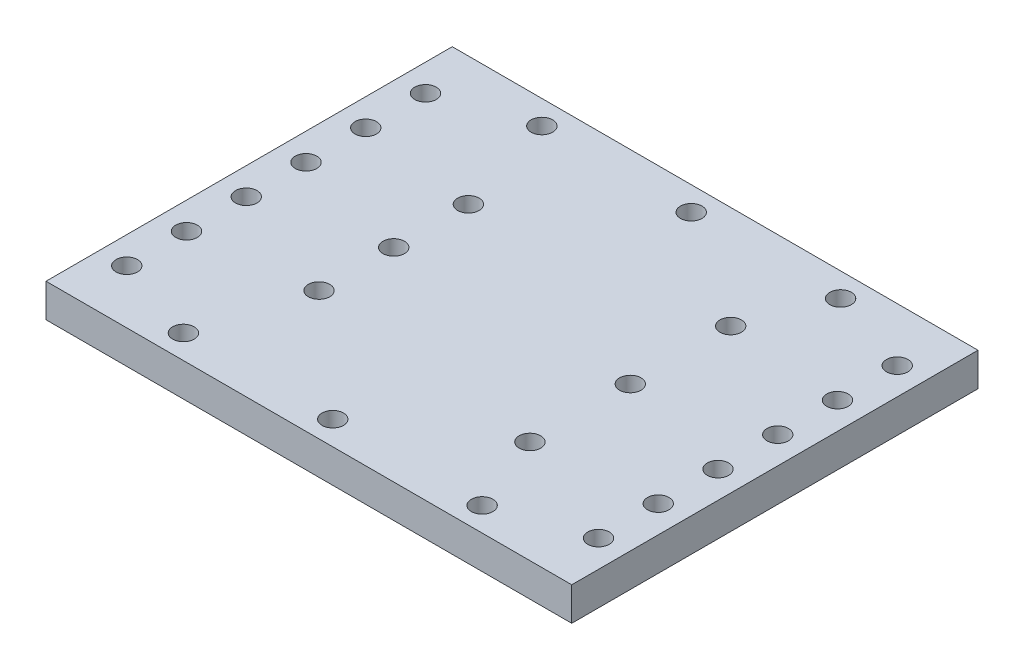
from build123d import *

# Parameters (mm, degrees)
SKETCH1_W           = 88
SKETCH1_H           = 68
BOSS_EXTRUDE1_DEPTH = 5.588
SKETCH2_R           = 1.8
CUT_EXTRUDE1_DEPTH  = 94.929750833


with BuildPart() as part:
    # Sketch1 → Boss-Extrude1 (new body)
    with BuildSketch(Plane(origin=(0, 0, 0), x_dir=(1, 0, 0), z_dir=(0, 1, 0))):
        with Locations((-43.165773612, -0.549967556)):
            Rectangle(SKETCH1_W, SKETCH1_H)
    extrude(amount=BOSS_EXTRUDE1_DEPTH)

    # Sketch2 → Cut-Extrude1 (cut, through all)
    with BuildSketch(Plane(origin=(0, 5.588, 0), x_dir=(1, 0, 0), z_dir=(0, 1, 0))):
        with Locations(Location((-68.165773612, 29.450032444, 0), (0, 0, 270))):
            Circle(SKETCH2_R)
        with Locations(Location((-43.165773612, 29.450032444, 0), (0, 0, 270))):
            Circle(SKETCH2_R)
        with Locations(Location((-18.165773612, 29.450032444, 0), (0, 0, 270))):
            Circle(SKETCH2_R)
        with Locations(Location((-43.165773612, -30.549967556, 0), (0, 0, 270))):
            Circle(SKETCH2_R)
        with Locations(Location((-68.165773612, -30.549967556, 0), (0, 0, 270))):
            Circle(SKETCH2_R)
        with Locations(Location((-18.165773612, -30.549967556, 0), (0, 0, 270))):
            Circle(SKETCH2_R)
        with Locations(Location((-62.965773612, -0.549967556, 0), (0, 0, 270))):
            Circle(SKETCH2_R)
        with Locations(Location((-23.365773612, -0.549967556, 0), (0, 0, 270))):
            Circle(SKETCH2_R)
        with Locations(Location((-23.365773612, -17.349967556, 0), (0, 0, 270))):
            Circle(SKETCH2_R)
        with Locations(Location((-23.365773612, 16.250032444, 0), (0, 0, 270))):
            Circle(SKETCH2_R)
        with Locations(Location((-62.965773612, -13.049967556, 0), (0, 0, 270))):
            Circle(SKETCH2_R)
        with Locations(Location((-62.965773612, 11.950032444, 0), (0, 0, 270))):
            Circle(SKETCH2_R)
        with Locations(Location((-82.645773612, 24.450032444, 0), (0, 0, 270))):
            Circle(SKETCH2_R)
        with Locations(Location((-3.685773612, 24.450032444, 0), (0, 0, 270))):
            Circle(SKETCH2_R)
        with Locations(Location((-82.645773612, 14.450032444, 0), (0, 0, 270))):
            Circle(SKETCH2_R)
        with Locations(Location((-3.685773612, 14.450032444, 0), (0, 0, 270))):
            Circle(SKETCH2_R)
        with Locations(Location((-82.645773612, 4.450032444, 0), (0, 0, 270))):
            Circle(SKETCH2_R)
        with Locations(Location((-3.685773612, 4.450032444, 0), (0, 0, 270))):
            Circle(SKETCH2_R)
        with Locations(Location((-82.645773612, -5.549967556, 0), (0, 0, 270))):
            Circle(SKETCH2_R)
        with Locations(Location((-3.685773612, -5.549967556, 0), (0, 0, 270))):
            Circle(SKETCH2_R)
        with Locations(Location((-82.645773612, -15.549967556, 0), (0, 0, 270))):
            Circle(SKETCH2_R)
        with Locations(Location((-3.685773612, -15.549967556, 0), (0, 0, 270))):
            Circle(SKETCH2_R)
        with Locations(Location((-82.645773612, -25.549967556, 0), (0, 0, 270))):
            Circle(SKETCH2_R)
        with Locations(Location((-3.685773612, -25.549967556, 0), (0, 0, 270))):
            Circle(SKETCH2_R)
    extrude(amount=-CUT_EXTRUDE1_DEPTH, mode=Mode.SUBTRACT)


solid = part.part
